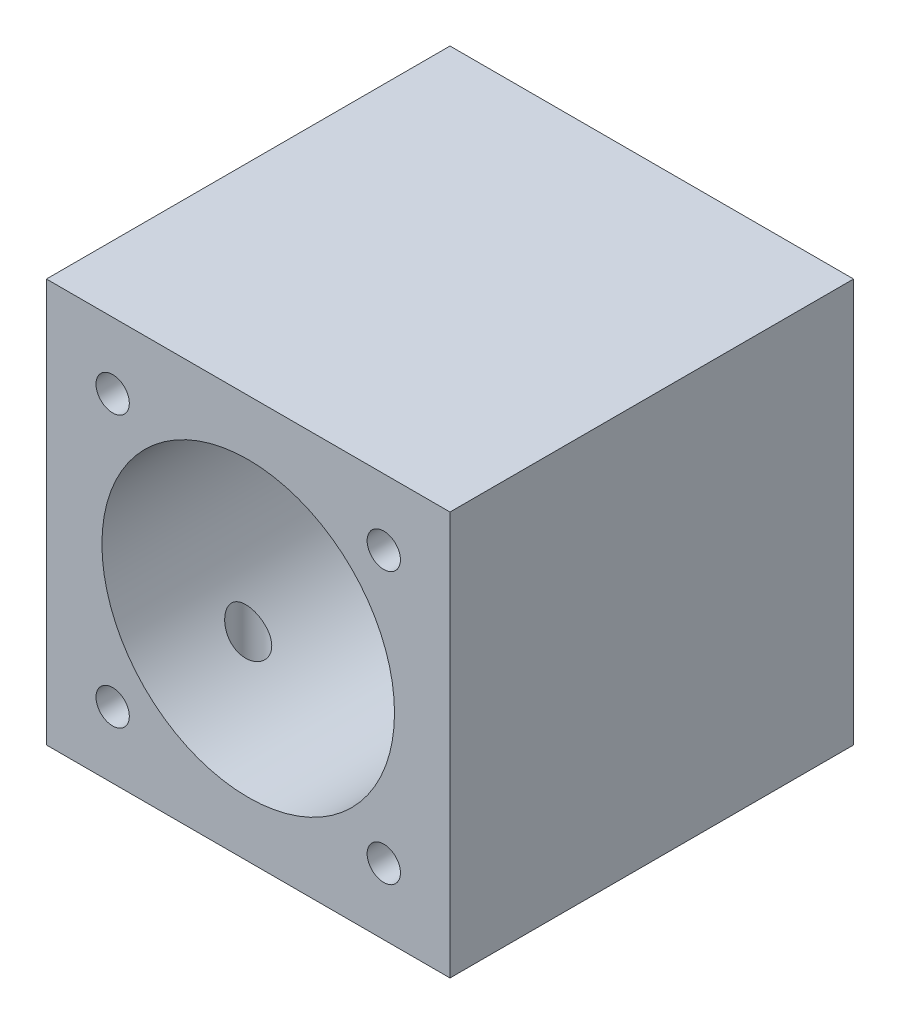
from build123d import *

# Parameters (mm, degrees)
SKETCH1_W             = 40
SKETCH1_H             = 40
SKETCH1_R             = 14.5
BOSS_EXTRUDE1_DEPTH   = 40
M4_TAPPED_HOLE1_D     = 3.3
M4_TAPPED_HOLE1_DEPTH = 16.1
M4_TAPPED_HOLE1_TIP   = 0.991420021
M4_TAPPED_HOLE2_D     = 3.3
M4_TAPPED_HOLE2_DEPTH = 16.1
M4_TAPPED_HOLE2_TIP   = 0.991420021


with BuildPart() as part:
    # Sketch1 → Boss-Extrude1 (new body)
    with BuildSketch(Plane.XY):
        Rectangle(SKETCH1_W, SKETCH1_H)
        Circle(SKETCH1_R, mode=Mode.SUBTRACT)
    extrude(amount=BOSS_EXTRUDE1_DEPTH)

    # M4 Tapped Hole1
    with Locations(Plane(origin=(-13.435028843, 13.435028843, 40), x_dir=(1, 0, 0), z_dir=(0, 0, 1))):
        with Locations((0, 0), (26.870057686, 0), (26.870057686, -26.870057686), (0, -26.870057686)):
            Hole(M4_TAPPED_HOLE1_D / 2, depth=M4_TAPPED_HOLE1_DEPTH)
            with Locations((0, 0, -(M4_TAPPED_HOLE1_DEPTH + M4_TAPPED_HOLE1_TIP / 2))):  # 118° drill point
                Cone(0, M4_TAPPED_HOLE1_D / 2, M4_TAPPED_HOLE1_TIP, mode=Mode.SUBTRACT)

    # M4 Tapped Hole2
    with Locations(Plane(origin=(-10, -20, 30), x_dir=(-1, 0, 0), z_dir=(0, -1, 0))):
        with Locations((0, 0), (-20, 0), (-20, 20), (0, 20)):
            Hole(M4_TAPPED_HOLE2_D / 2, depth=M4_TAPPED_HOLE2_DEPTH)
            with Locations((0, 0, -(M4_TAPPED_HOLE2_DEPTH + M4_TAPPED_HOLE2_TIP / 2))):  # 118° drill point
                Cone(0, M4_TAPPED_HOLE2_D / 2, M4_TAPPED_HOLE2_TIP, mode=Mode.SUBTRACT)


solid = part.part
